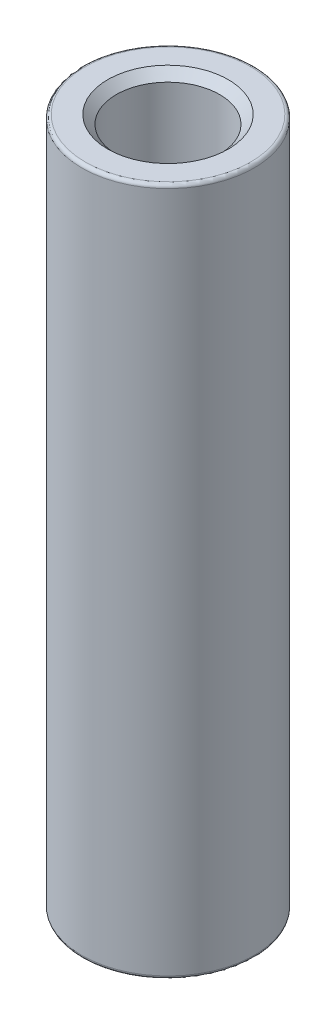
from build123d import *

# Parameters (mm, degrees)
SKETCH1_R           = 2.5
SKETCH1_R_2         = 1.5
BOSS_EXTRUDE1_DEPTH = 10
CHAMFER1_SIZE       = 0.25
FILLET1_R           = 0.1


with BuildPart() as part:
    # Sketch1 → Boss-Extrude1 (new, symmetric)
    with BuildSketch(Plane(origin=(0, 0, 0), x_dir=(1, 0, 0), z_dir=(0, 1, 0))):
        with Locations(Location((0, 0, 0), (0, 0, 270))):
            Circle(SKETCH1_R)
        with Locations(Location((0, 0, 0), (0, 0, 270))):
            Circle(SKETCH1_R_2, mode=Mode.SUBTRACT)
    extrude(amount=BOSS_EXTRUDE1_DEPTH, both=True)

    # Chamfer1
    chamfer1_edges = [part.edges().sort_by_distance(p)[0] for p in [
        (0, -10, -1.5),
        (0, 10, -1.5),
    ]]
    chamfer(chamfer1_edges, length=CHAMFER1_SIZE)

    # Fillet1
    fillet1_edges = [part.edges().sort_by_distance(p)[0] for p in [
        (0, -10, -2.5),
        (0, 10, -2.5),
    ]]
    fillet(fillet1_edges, radius=FILLET1_R)


solid = part.part
